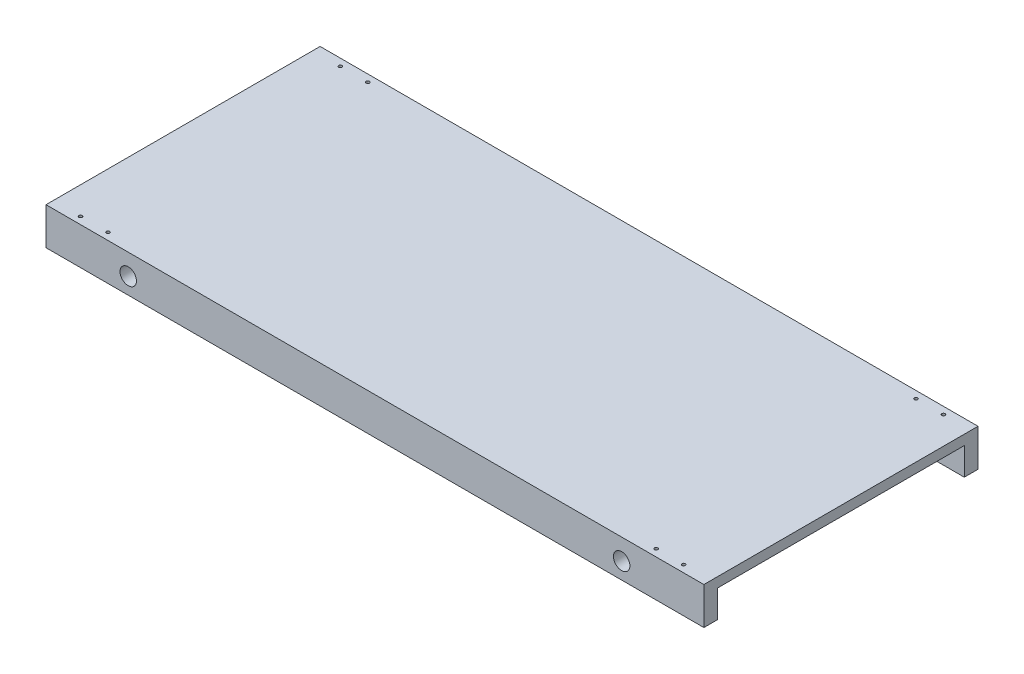
from build123d import *

# Parameters (mm, degrees)
SKETCH1_W                = 1200
SKETCH1_H                = 500
BOSS_EXTRUDE1_DEPTH      = 68
SKETCH3_R                = 15
CUT_EXTRUDE2_DEPTH       = 1302.77724669
SKETCH4_R                = 15
CUT_EXTRUDE3_DEPTH       = 1302.77724669
SKETCH2_W                = 1200
SKETCH2_H                = 450
CUT_EXTRUDE1_DEPTH       = 50
F_6_0_6_DIAMETER_HOLE1_D = 6
F_6_0_6_DIAMETER_HOLE2_D = 6
F_6_0_6_DIAMETER_HOLE3_D = 6


with BuildPart() as part:
    # Sketch1 → Boss-Extrude1 (new body)
    with BuildSketch(Plane(origin=(0, 0, 0), x_dir=(1, 0, 0), z_dir=(0, 1, 0))):
        with Locations((600, 250)):
            Rectangle(SKETCH1_W, SKETCH1_H)
    extrude(amount=BOSS_EXTRUDE1_DEPTH)

    # Sketch3 → Cut-Extrude2 (cut, through all)
    with BuildSketch(Plane.XY):
        with Locations((150, 30)):
            Circle(SKETCH3_R)
    extrude(amount=-CUT_EXTRUDE2_DEPTH, mode=Mode.SUBTRACT)

    # Sketch4 → Cut-Extrude3 (cut, through all)
    with BuildSketch(Plane(origin=(0, 0, -500), x_dir=(-1, 0, 0), z_dir=(0, 0, -1))):
        with Locations((-1050, 30)):
            Circle(SKETCH4_R)
    extrude(amount=-CUT_EXTRUDE3_DEPTH, mode=Mode.SUBTRACT)

    # Sketch2 → Cut-Extrude1 (cut)
    with BuildSketch(Plane.XZ):
        with Locations((600, -250)):
            Rectangle(SKETCH2_W, SKETCH2_H)
    extrude(amount=-CUT_EXTRUDE1_DEPTH, mode=Mode.SUBTRACT)

    # Ø6.0 (6) Diameter Hole1 (through all)
    with Locations(Plane(origin=(0, 68, 0), x_dir=(1, 0, 0), z_dir=(0, 1, 0))):
        with Locations((50, 487)):
            Hole(F_6_0_6_DIAMETER_HOLE1_D / 2)

    # Ø6.0 (6) Diameter Hole2 (through all)
    with Locations(Plane(origin=(0, 68, 0), x_dir=(1, 0, 0), z_dir=(0, 1, 0))):
        with Locations((100, 487)):
            Hole(F_6_0_6_DIAMETER_HOLE2_D / 2)

    # Ø6.0 (6) Diameter Hole3 (through all)
    with Locations(Plane(origin=(0, 68, 0), x_dir=(1, 0, 0), z_dir=(0, 1, 0))):
        with Locations((1150, 487), (1100, 487), (1100, 13), (1150, 13), (50, 13), (100, 13)):
            Hole(F_6_0_6_DIAMETER_HOLE3_D / 2)


solid = part.part
